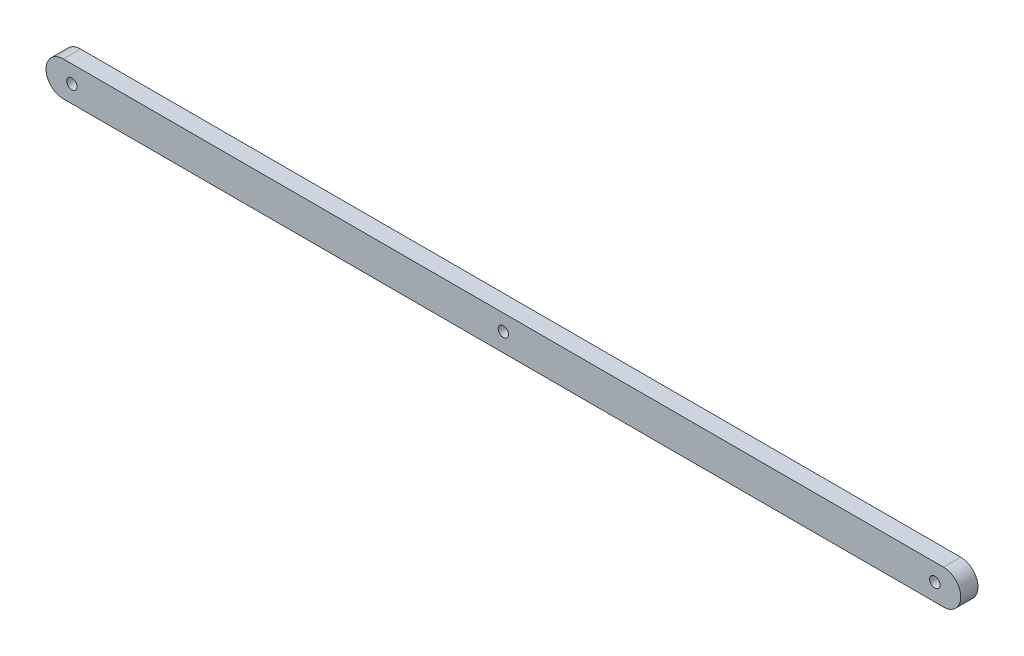
from build123d import *

# Parameters (mm, degrees)
ESQUISSE1_R             = 3
BOSS_EXTRU_1_DEPTH      = 10
ENL_V_START             = -10
ESQUISSE2_R             = 3
ENL_V_MAT_EXTRU_1_DEPTH = 10


with BuildPart() as part:
    # Esquisse1 → Boss.-Extru.1 (new body)
    with BuildSketch(Plane.XY):
        with BuildLine():
            Line((-122.628083491, -8.225806452), (387.371916509, -8.225806452))
            ThreePointArc((387.371916509, -8.225806452), (397.371916509, -18.225806452), (387.371916509, -28.225806452))
            Line((387.371916509, -28.225806452), (-122.628083491, -28.225806452))
            ThreePointArc((-122.628083491, -28.225806452), (-132.628083491, -18.225806452), (-122.628083491, -8.225806452))
        make_face()
        with Locations((-117.628083491, -18.225806452)):
            Circle(ESQUISSE1_R, mode=Mode.SUBTRACT)
        with Locations((382.371916509, -18.225806452)):
            Circle(ESQUISSE1_R, mode=Mode.SUBTRACT)
    extrude(amount=BOSS_EXTRU_1_DEPTH)

    # Esquisse2 → Enlèv. mat.-Extru.1 (cut)
    with BuildSketch(Plane.XY.offset(10).offset(ENL_V_START)):
        with Locations((132.370892359, -17.510213181)):
            Circle(ESQUISSE2_R)
        with Locations((-117.628083491, -18.225806452)):
            Circle(ESQUISSE2_R)
    extrude(amount=ENL_V_MAT_EXTRU_1_DEPTH, mode=Mode.SUBTRACT)


solid = part.part
